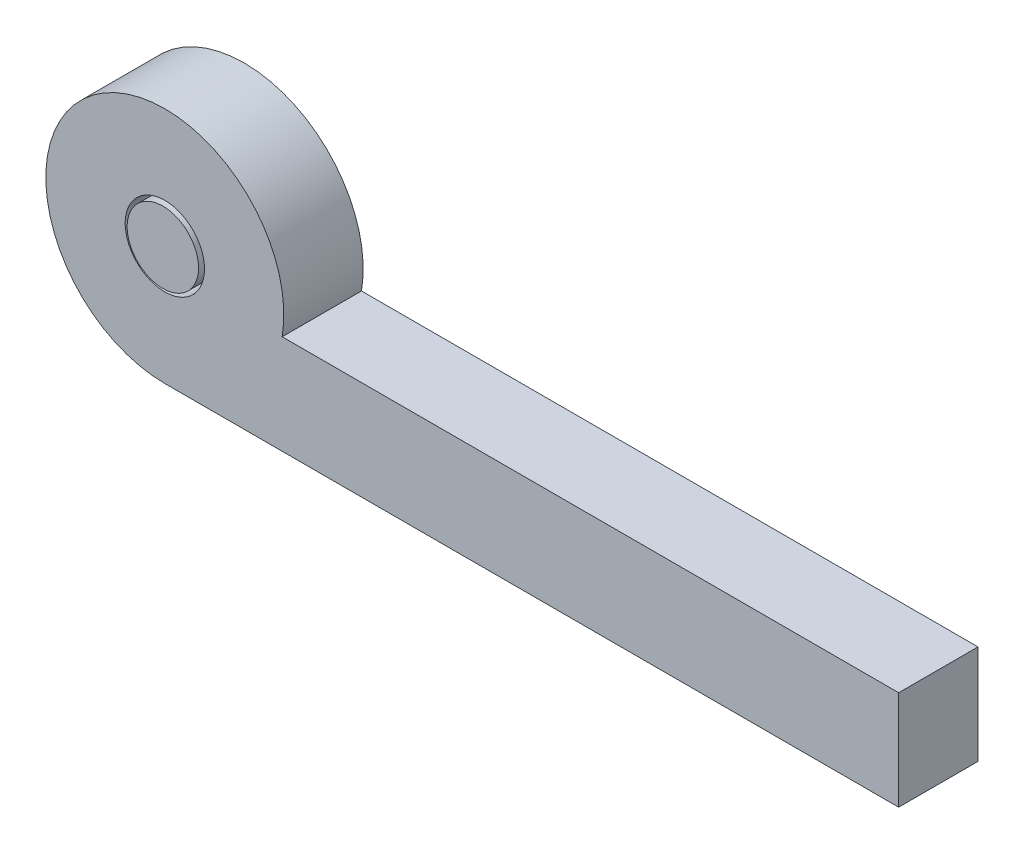
from build123d import *

# Parameters (mm, degrees)
SKETCH1_R           = 19.05
BOSS_EXTRUDE1_DEPTH = 6.35
BOSS_EXTRUDE2_DEPTH = 12.7
SKETCH3_R           = 6.35
CUT_EXTRUDE1_DEPTH  = 111.807045128
SKETCH4_R           = 5.715
BOSS_EXTRUDE3_DEPTH = 6.6675


with BuildPart() as part:
    # Sketch1 → Boss-Extrude1 (new, symmetric)
    with BuildSketch(Plane.XY):
        with Locations((-73.025, -41.275)):
            Circle(SKETCH1_R)
    extrude(amount=BOSS_EXTRUDE1_DEPTH, both=True)

    # Sketch2 → Boss-Extrude2 (add)
    with BuildSketch(Plane.XY.offset(6.35)):
        with BuildLine():
            Line((-54.241446689, -44.45), (44.45, -44.45))
            Line((44.45, -44.45), (44.45, -60.325))
            Line((44.45, -60.325), (-73.025, -60.325))
            ThreePointArc((-73.025, -60.325), (-60.728277876, -55.824677831), (-54.241446689, -44.45))
        make_face()
    extrude(amount=-BOSS_EXTRUDE2_DEPTH)

    # Sketch3 → Cut-Extrude1 (cut, through all)
    with BuildSketch(Plane.XY.offset(6.35)):
        with Locations((-73.025, -41.275)):
            Circle(SKETCH3_R)
    extrude(amount=-CUT_EXTRUDE1_DEPTH, mode=Mode.SUBTRACT)


with BuildPart() as body_2:
    # Sketch4 → Boss-Extrude3 (new, symmetric)
    with BuildSketch(Plane.XY):
        with Locations((-73.025, -41.275)):
            Circle(SKETCH4_R)
    extrude(amount=BOSS_EXTRUDE3_DEPTH, both=True)


solid = Compound([part.part, body_2.part])
